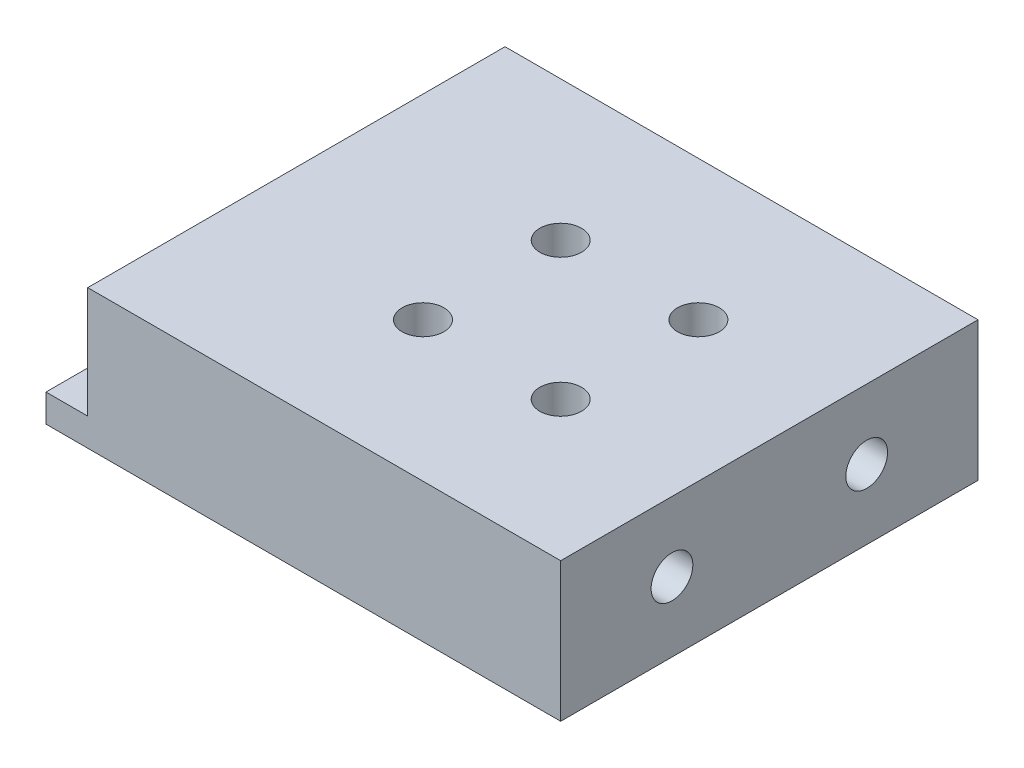
from build123d import *

# Parameters (mm, degrees)
SKETCH_1_W          = 37
SKETCH_1_H          = 30
SKETCH_1_R          = 1.5
EXTRUDE_1_DEPTH     = 10
SKETCH_2_R          = 1.5
CUT_EXTRUDE_1_DEPTH = 6
SKETCH_3_W          = 30
SKETCH_3_H          = 8
CUT_EXTRUDE_2_DEPTH = 3
SKETCH_4_R          = 1
CUT_EXTRUDE_3_DEPTH = 7


with BuildPart() as part:
    # Эскиз1 → Бобышка-Вытянуть1 (new body)
    with BuildSketch(Plane(origin=(0, 0, 0), x_dir=(1, 0, 0), z_dir=(0, 1, 0))):
        with Locations((18.5, 15)):
            Rectangle(SKETCH_1_W, SKETCH_1_H)
        with Locations(Location((26.949747468, 19.949747468, 0), (0, 0, 270))):
            Circle(SKETCH_1_R, mode=Mode.SUBTRACT)
        with Locations(Location((17.050252532, 19.949747468, 0), (0, 0, 270))):
            Circle(SKETCH_1_R, mode=Mode.SUBTRACT)
        with Locations(Location((26.949747468, 10.050252532, 0), (0, 0, 270))):
            Circle(SKETCH_1_R, mode=Mode.SUBTRACT)
        with Locations(Location((17.050252532, 10.050252532, 0), (0, 0, 270))):
            Circle(SKETCH_1_R, mode=Mode.SUBTRACT)
    extrude(amount=EXTRUDE_1_DEPTH)

    # Эскиз2 → Вырез-Вытянуть1 (cut)
    with BuildSketch(Plane(origin=(37, 0, 0), x_dir=(0, 0, -1), z_dir=(1, 0, 0))):
        with Locations((8, 5)):
            Circle(SKETCH_2_R)
        with Locations((22, 5)):
            Circle(SKETCH_2_R)
    extrude(amount=-CUT_EXTRUDE_1_DEPTH, mode=Mode.SUBTRACT)

    # Эскиз3 → Вырез-Вытянуть2 (cut)
    with BuildSketch(Plane.ZY):
        with Locations((-15, 6)):
            Rectangle(SKETCH_3_W, SKETCH_3_H)
    extrude(amount=-CUT_EXTRUDE_2_DEPTH, mode=Mode.SUBTRACT)

    # Эскиз4 → Вырез-Вытянуть3 (cut)
    with BuildSketch(Plane.ZY):
        with Locations((-20, 5.4)):
            Circle(SKETCH_4_R)
        with Locations((-10, 5.4)):
            Circle(SKETCH_4_R)
    extrude(amount=-CUT_EXTRUDE_3_DEPTH, mode=Mode.SUBTRACT)


solid = part.part
